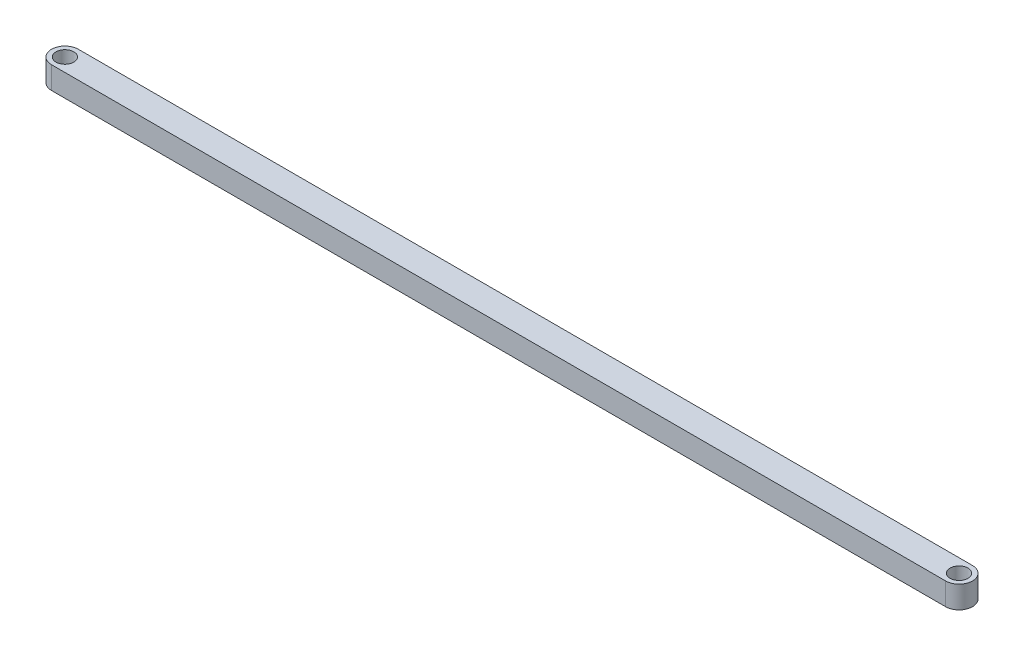
from build123d import *

# Parameters (mm, degrees)
BOSS_EXTRUDE1_DEPTH = 2.5


with BuildPart() as part:
    # Sketch1 → Boss-Extrude1 (new body)
    with BuildSketch(Plane(origin=(0, 0, 0), x_dir=(1, 0, 0), z_dir=(0, 1, 0))):
        with BuildLine():
            ThreePointArc((-50, 1.5), (-51.5, 0), (-50, -1.5))
            Line((-50, -1.5), (-50, -1))
            ThreePointArc((-50, -1), (-51, 0), (-50, 1))
            Line((-50, 1), (-50, 1.5))
        make_face()
        with BuildLine():
            Line((-50, -1), (-50, -1.5))
            ThreePointArc((-50, -1.5), (-48.939339828, -1.060660172), (-48.5, 0))
            ThreePointArc((-48.5, 0), (-48.939339828, 1.060660172), (-50, 1.5))
            Line((-50, 1.5), (-50, 1))
            ThreePointArc((-50, 1), (-49.292893219, 0.707106781), (-49, 0))
            ThreePointArc((-49, 0), (-49.292893219, -0.707106781), (-50, -1))
        make_face()
        with BuildLine():
            ThreePointArc((-48.5, 0), (-48.939339828, -1.060660172), (-50, -1.5))
            Line((-50, -1.5), (50, -1.5))
            ThreePointArc((50, -1.5), (48.5, 0), (50, 1.5))
            Line((50, 1.5), (-50, 1.5))
            ThreePointArc((-50, 1.5), (-48.939339828, 1.060660172), (-48.5, 0))
        make_face()
        with BuildLine():
            ThreePointArc((50, 1.5), (48.5, 0), (50, -1.5))
            Line((50, -1.5), (50, -1))
            ThreePointArc((50, -1), (49, 0), (50, 1))
            Line((50, 1), (50, 1.5))
        make_face()
        with BuildLine():
            Line((50, -1), (50, -1.5))
            ThreePointArc((50, -1.5), (51.060660172, -1.060660172), (51.5, 0))
            ThreePointArc((51.5, 0), (51.060660172, 1.060660172), (50, 1.5))
            Line((50, 1.5), (50, 1))
            ThreePointArc((50, 1), (50.707106781, 0.707106781), (51, 0))
            ThreePointArc((51, 0), (50.707106781, -0.707106781), (50, -1))
        make_face()
    extrude(amount=BOSS_EXTRUDE1_DEPTH)


solid = part.part
